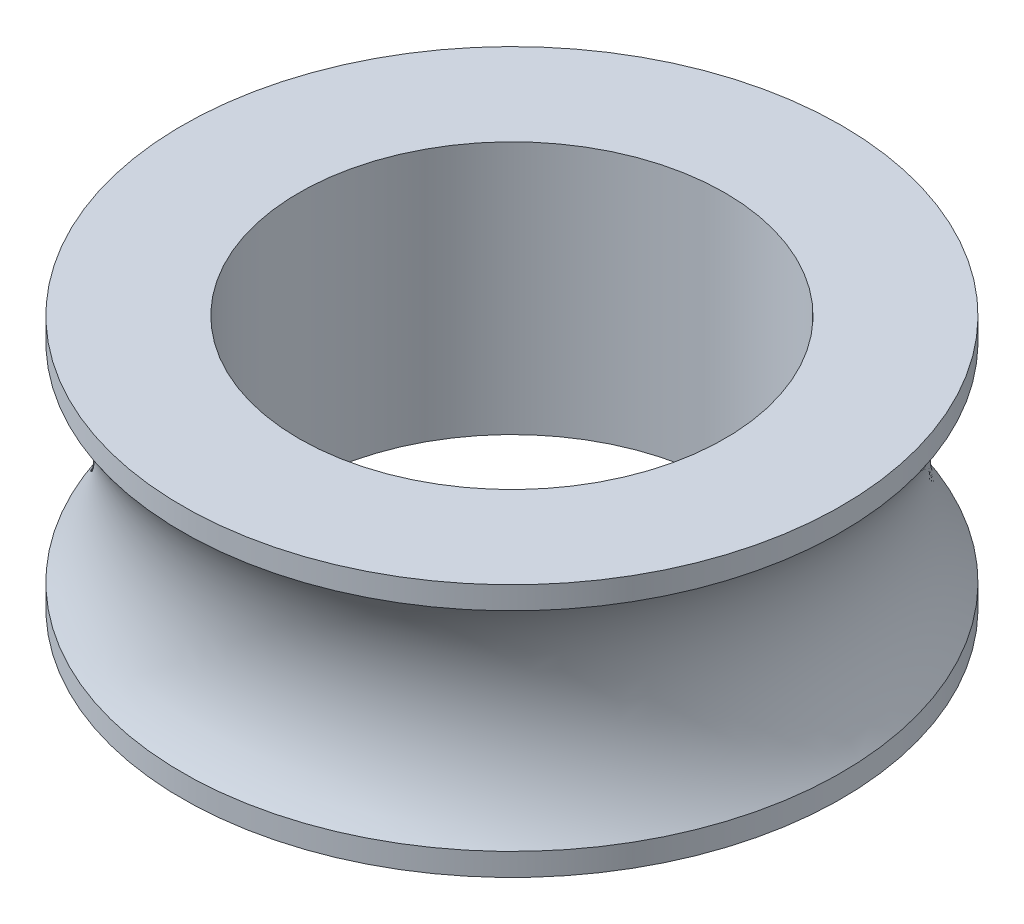
from build123d import *

# Parameters (mm, degrees)
SKETCH_2_R          = 25.2
CUT_EXTRUDE_1_DEPTH = 63.785348609


with BuildPart() as part:
    # 草图1 → 旋转1 (revolve)
    with BuildSketch(Plane.XY, mode=Mode.PRIVATE) as revolve_1_sk:
        with BuildLine():
            Line((39, 27.328828006), (39, 30))
            Line((39, 30), (0, 30))
            Line((0, 30), (0, 0))
            Line((0, 0), (39, 0))
            Line((39, 0), (39, 2.671171994))
            ThreePointArc((39, 2.671171994), (35, 15), (39, 27.328828006))
        make_face()
    revolve(revolve_1_sk.sketch.rotate(Axis((0, 0, 0), (0, 1, 0)), 90), axis=Axis((0, 0, 0), (0, 1, 0)))

    # 草图2 → 切除-拉伸1 (cut, through all)
    with BuildSketch(Plane(origin=(0, 30, 0), x_dir=(1, 0, 0), z_dir=(0, 1, 0))):
        with Locations(Location((0, 0, 0), (0, 0, 270))):
            Circle(SKETCH_2_R)
    extrude(amount=-CUT_EXTRUDE_1_DEPTH, mode=Mode.SUBTRACT)


solid = part.part
